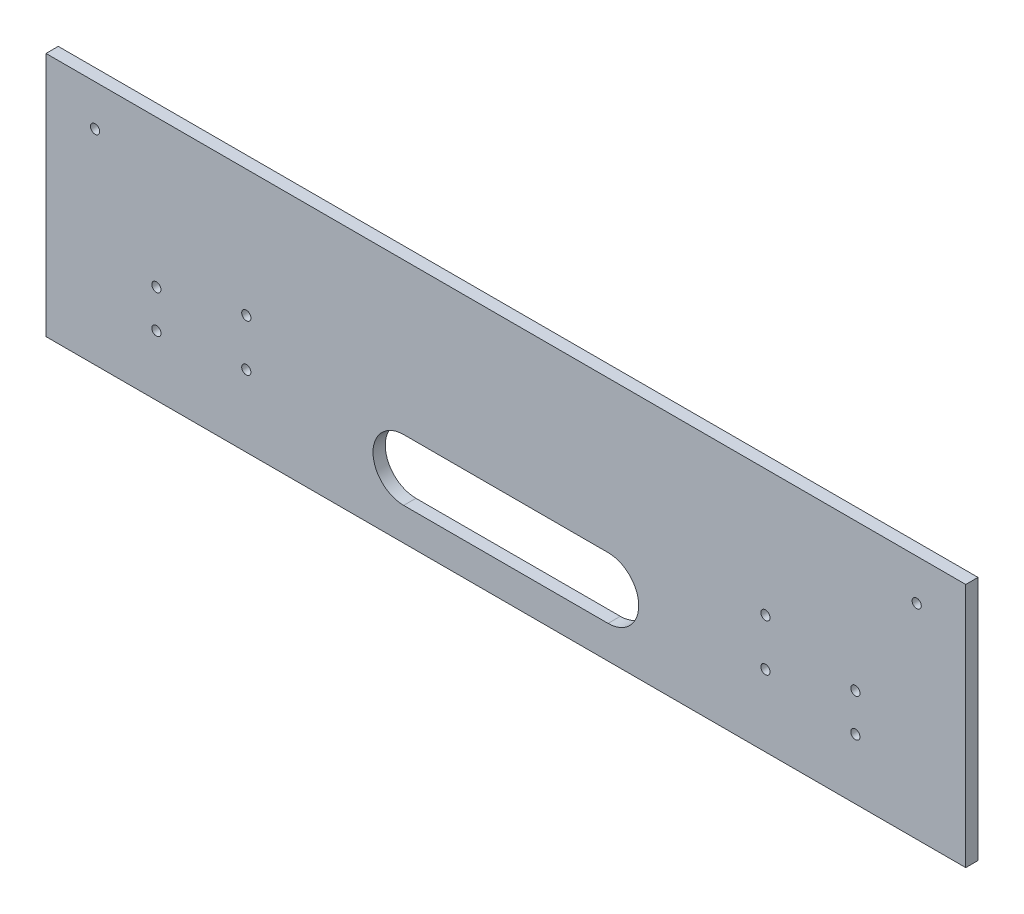
from build123d import *

# Parameters (mm, degrees)
SCHIZZO1_W                   = 450
SCHIZZO1_H                   = 120
ESTRUSIONE_ESTRUSIONE1_DEPTH = 6
TAGLIO_ESTRUSIONE1_DEPTH     = 10
SCHIZZO3_R                   = 2.25
TAGLIO_ESTRUSIONE2_DEPTH     = 10


with BuildPart() as part:
    # Schizzo1 → Estrusione-Estrusione1 (new body)
    with BuildSketch(Plane.XY):
        Rectangle(SCHIZZO1_W, SCHIZZO1_H)
    extrude(amount=ESTRUSIONE_ESTRUSIONE1_DEPTH)

    # Schizzo2 → Taglio-Estrusione1 (cut)
    with BuildSketch(Plane.XY.offset(6)):
        with BuildLine():
            Line((-50, -14), (50, -14))
            ThreePointArc((50, -14), (65, -29), (50, -44))
            Line((50, -44), (-50, -44))
            ThreePointArc((-50, -44), (-65, -29), (-50, -14))
        make_face()
    extrude(amount=-TAGLIO_ESTRUSIONE1_DEPTH, mode=Mode.SUBTRACT)

    # Schizzo3 → Taglio-Estrusione2 (cut)
    with BuildSketch(Plane(origin=(0, 0, 0), x_dir=(-1, 0, 0), z_dir=(0, 0, -1))):
        with Locations((-171, -12)):
            Circle(SCHIZZO3_R)
        with Locations((-171, -30.5)):
            Circle(SCHIZZO3_R)
        with Locations((171, -12)):
            Circle(SCHIZZO3_R)
        with Locations((171, -30.5)):
            Circle(SCHIZZO3_R)
        with Locations((201, 40)):
            Circle(SCHIZZO3_R)
        with Locations((-201, 40)):
            Circle(SCHIZZO3_R)
        with Locations((-127, -2)):
            Circle(SCHIZZO3_R)
        with Locations((-127, -25)):
            Circle(SCHIZZO3_R)
        with Locations((127, -2)):
            Circle(SCHIZZO3_R)
        with Locations((127, -25)):
            Circle(SCHIZZO3_R)
    extrude(amount=-TAGLIO_ESTRUSIONE2_DEPTH, mode=Mode.SUBTRACT)


solid = part.part
